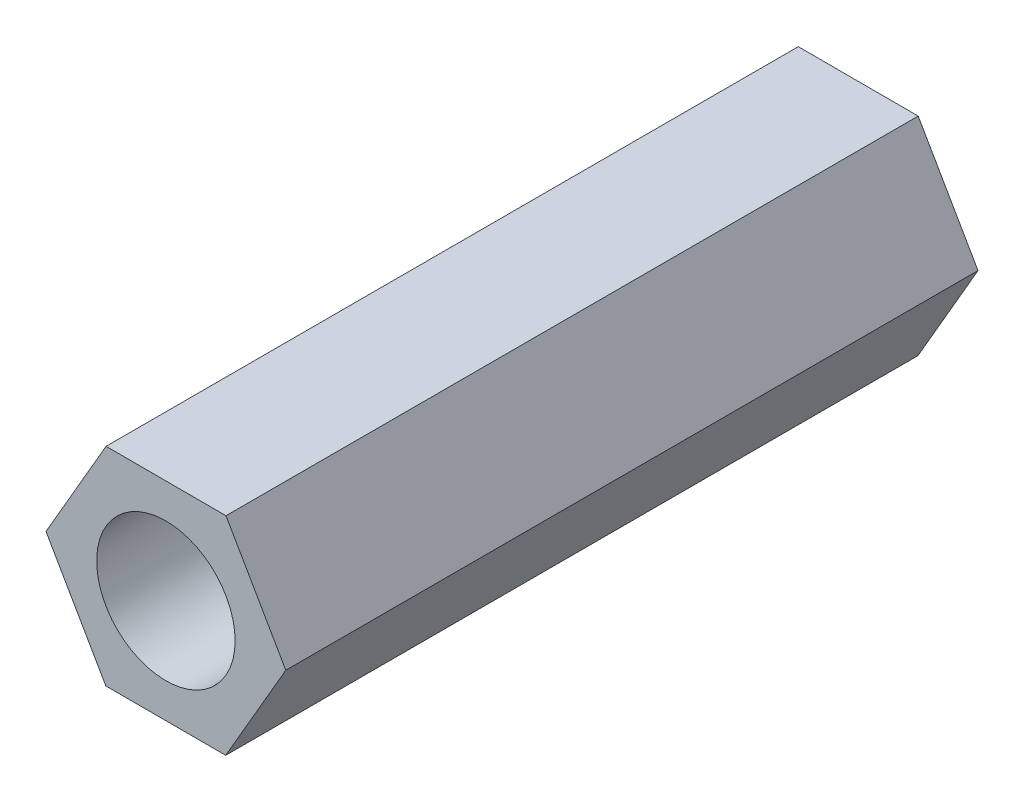
from build123d import *

# Parameters (mm, degrees)
SKETCH2_R           = 3
SKETCH2_R_2         = 2
BOSS_EXTRUDE1_DEPTH = 20


with BuildPart() as part:
    # Sketch2 → Boss-Extrude1 (new body)
    # profile 1 of 7: a face of its own
    with BuildSketch(Plane.XY):
        Circle(SKETCH2_R)
        Circle(SKETCH2_R_2, mode=Mode.SUBTRACT)
    # profile 2 of 7: a face of its own
    with BuildSketch(Plane.XY):
        with BuildLine():
            Line((0.00424563, 2.999996996), (-1.7278037, 3.002448064))
            Line((-1.7278037, 3.002448064), (-2.595950792, 1.503675326))
            ThreePointArc((-2.595950792, 1.503675326), (-1.496321672, 2.600196426), (0.00424563, 2.999996996))
        make_face()
    # profile 3 of 7: a face of its own
    with BuildSketch(Plane.XY):
        with BuildLine():
            Line((1.736294447, 2.997545929), (0.00424563, 2.999996996))
            ThreePointArc((0.00424563, 2.999996996), (1.503675324, 2.595950793), (2.600196428, 1.496321669))
            Line((2.600196428, 1.496321669), (1.736294447, 2.997545929))
        make_face()
    # profile 4 of 7: a face of its own
    with BuildSketch(Plane.XY):
        with BuildLine():
            Line((3.464098147, -0.004902135), (2.600196428, 1.496321669))
            ThreePointArc((2.600196428, 1.496321669), (2.898326179, 0.774406456), (3, 0))
            ThreePointArc((3, 0), (2.897227326, -0.778507431), (2.595950787, -1.503675335))
            Line((2.595950787, -1.503675335), (3.464098147, -0.004902135))
        make_face()
    # profile 5 of 7: a face of its own
    with BuildSketch(Plane.XY):
        with BuildLine():
            ThreePointArc((2.595950787, -1.503675335), (1.496321666, -2.60019643), (-0.004245634, -2.999996996))
            Line((-0.004245634, -2.999996996), (1.7278037, -3.002448064))
            Line((1.7278037, -3.002448064), (2.595950787, -1.503675335))
        make_face()
    # profile 6 of 7: a face of its own
    with BuildSketch(Plane.XY):
        with BuildLine():
            ThreePointArc((-0.004245634, -2.999996996), (-1.503675323, -2.595950794), (-2.600196425, -1.496321674))
            Line((-2.600196425, -1.496321674), (-1.736294447, -2.997545929))
            Line((-1.736294447, -2.997545929), (-0.004245634, -2.999996996))
        make_face()
    # profile 7 of 7: a face of its own
    with BuildSketch(Plane.XY):
        with BuildLine():
            ThreePointArc((-2.600196425, -1.496321674), (-2.999996996, 0.004245633), (-2.595950792, 1.503675326))
            Line((-2.595950792, 1.503675326), (-3.464098147, 0.004902135))
            Line((-3.464098147, 0.004902135), (-2.600196425, -1.496321674))
        make_face()
    extrude(amount=BOSS_EXTRUDE1_DEPTH)


solid = part.part
